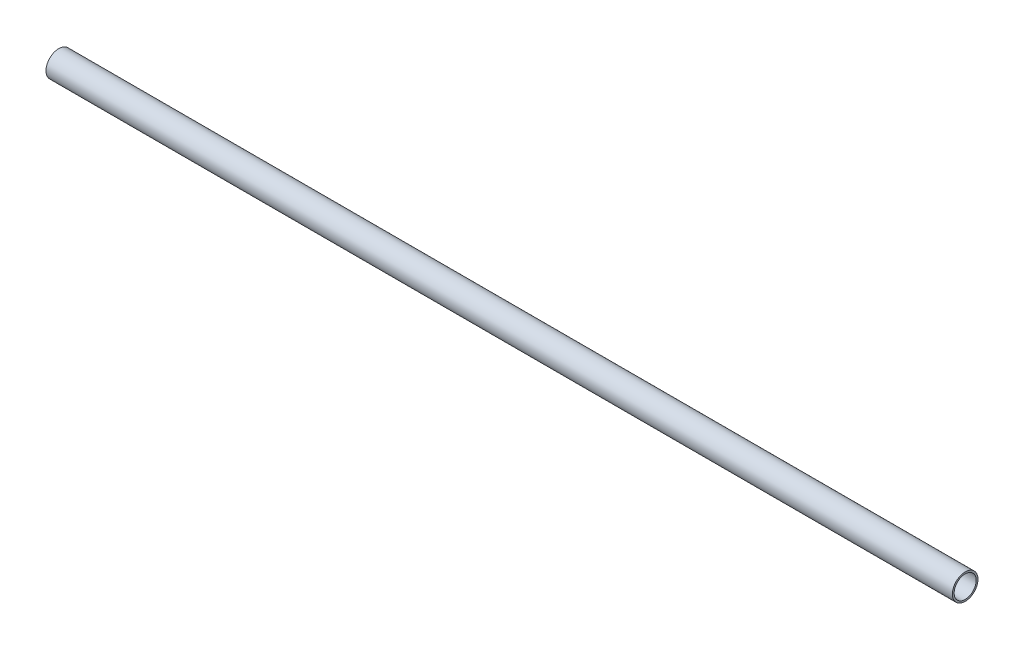
from build123d import *

# Parameters (mm, degrees)
SKETCH1_R           = 30.1625
SKETCH1_R_2         = 25.9969
BOSS_EXTRUDE1_DEPTH = 2133.6


with BuildPart() as part:
    # Sketch1 → Boss-Extrude1 (new body)
    with BuildSketch(Plane(origin=(0, 0, 0), x_dir=(0, 0, -1), z_dir=(1, 0, 0))):
        Circle(SKETCH1_R)
        Circle(SKETCH1_R_2, mode=Mode.SUBTRACT)
    extrude(amount=BOSS_EXTRUDE1_DEPTH)


solid = part.part
